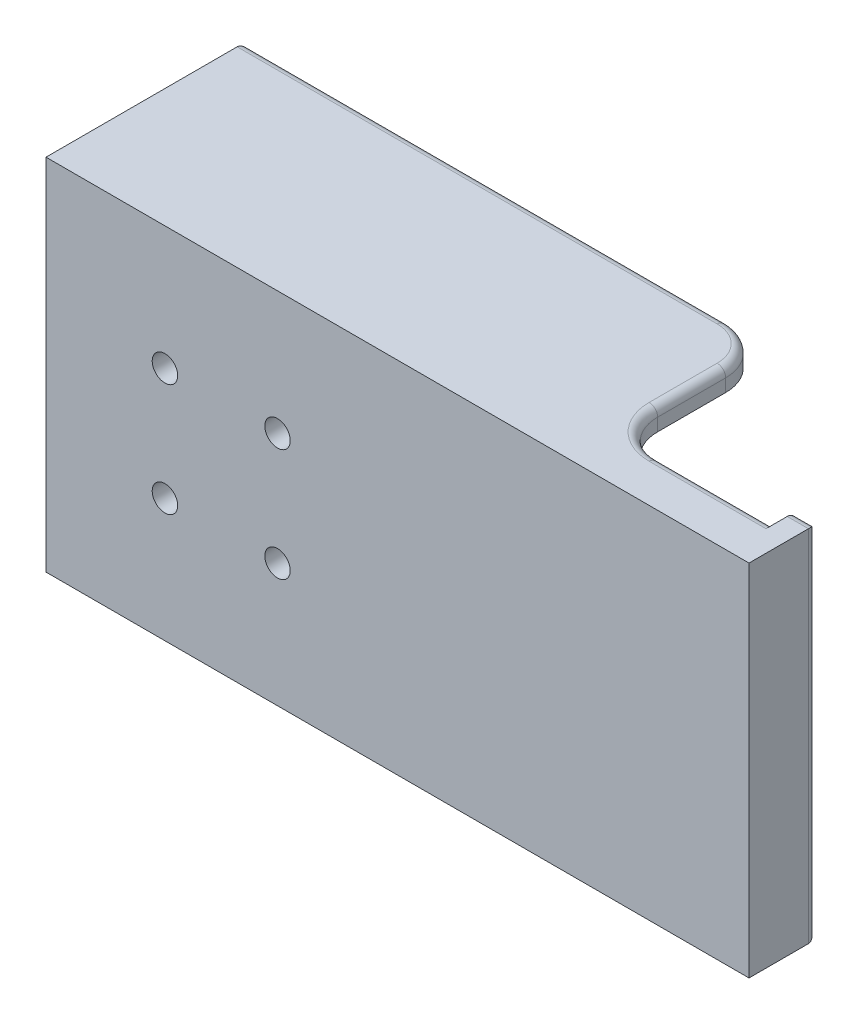
from build123d import *

# Parameters (mm, degrees)
CROQUIS1_W                 = 118
CROQUIS1_H                 = 84.6
SALIENTE_EXTRUIR1_DEPTH    = 36
CROQUIS2_W                 = 36
CROQUIS2_H                 = 74.6
CORTAR_EXTRUIR1_DEPTH      = 120
CORTAR_EXTRUIR3_DEPTH      = 110.243581047
SALIENTE_EXTRUIR2_DEPTH    = 84.6
CROQUIS8_W                 = 160.5
CROQUIS8_H                 = 84.6
SALIENTE_EXTRUIR3_DEPTH    = 5
CROQUIS9_W                 = 41
CROQUIS9_H                 = 84.6
SALIENTE_EXTRUIR4_DEPTH    = 5
CROQUIS10_W                = 5
CROQUIS10_H                = 84.6
SALIENTE_EXTRUIR5_DEPTH    = 5
REDONDEO2_R                = 10
REDONDEO3_R                = 2
REDONDEO4_R                = 2
CROQUIS18_W                = 165.5
CROQUIS18_H                = 84.6
SALIENTE_EXTRUIR9_DEPTH    = 6
CORTAR_EXTRUIR6_DEPTH      = 120.584865263
CORTAR_EXTRUIR6_DEPTH_BACK = 120.584865263
CROQUIS11_R                = 6
CROQUIS16_R                = 6
SALIENTE_EXTRUIR8_DEPTH    = 5
CROQUIS17_R                = 3
CORTAR_EXTRUIR7_DEPTH      = 120.584865302


with BuildPart() as part:
    # Croquis1 → Saliente-Extruir1 (new body)
    with BuildSketch(Plane.XY):
        Rectangle(CROQUIS1_W, CROQUIS1_H)
    extrude(amount=SALIENTE_EXTRUIR1_DEPTH)

    # Croquis2 → Cortar-Extruir1 (cut)
    with BuildSketch(Plane(origin=(59, 0, 0), x_dir=(0, 0, -1), z_dir=(1, 0, 0))):
        with Locations((-18, 0)):
            Rectangle(CROQUIS2_W, CROQUIS2_H)
    extrude(amount=-CORTAR_EXTRUIR1_DEPTH, mode=Mode.SUBTRACT)


with BuildPart() as cortar_extruir1_piece_1:
    # of the separate pieces the step leaves, piece 1, a body of its own (cortar_extruir1_pieces)
    add(part.part.solids().sort_by_distance((-59, -42.3, 0))[0])


with BuildPart() as cortar_extruir1_piece_2:
    # of the separate pieces the step leaves, piece 2, a body of its own (cortar_extruir1_pieces)
    add(part.part.solids().sort_by_distance((-59, 42.3, 0))[0])


with BuildPart() as cortar_extruir3_tool:
    # Croquis6 → Cortar-Extruir3 (new, through all)
    with BuildSketch(Plane.XZ.offset(42.3)):
        with BuildLine():
            Line((-59, 0), (-59, 36))
            Line((-59, 36), (0, 36))
            ThreePointArc((0, 36), (-33.535731191, 24.614115008), (-59, 0))
        make_face()
    extrude(amount=-CORTAR_EXTRUIR3_DEPTH)


with BuildPart() as cortar_extruir1_piece_1_1:
    add(cortar_extruir1_piece_1.part)

    # Cortar-Extruir3: cut by cortar_extruir3_tool
    add(cortar_extruir3_tool.part, mode=Mode.SUBTRACT)



with BuildPart() as cortar_extruir1_piece_2_1:
    add(cortar_extruir1_piece_2.part)

    # Cortar-Extruir3: cut by cortar_extruir3_tool
    add(cortar_extruir3_tool.part, mode=Mode.SUBTRACT)


with BuildPart() as body_3:
    # Croquis7 → Saliente-Extruir2 (new, through all)
    with BuildSketch(Plane.XZ.offset(-42.3)):
        with BuildLine():
            Line((-59, 0), (-59, 36))
            Line((-59, 36), (0, 36))
            ThreePointArc((0, 36), (-33.535731191, 24.614115008), (-59, 0))
        make_face()
    extrude(amount=SALIENTE_EXTRUIR2_DEPTH)


with BuildPart() as cortar_extruir1_piece_1_2:
    add(cortar_extruir1_piece_1_1.part)

    add(cortar_extruir1_piece_2_1.part)  # Saliente-Extruir3 merges Cortar-Extruir1 piece 2

    add(body_3.part)  # Saliente-Extruir3 merges body 3
    # Croquis8 → Saliente-Extruir3 (add)
    with BuildSketch(Plane.XY.offset(36)):
        with Locations((21.25, 0)):
            Rectangle(CROQUIS8_W, CROQUIS8_H)
    extrude(amount=SALIENTE_EXTRUIR3_DEPTH)

    # Croquis9 → Saliente-Extruir4 (add)
    with BuildSketch(Plane.ZY.offset(59)):
        with Locations((20.5, 0)):
            Rectangle(CROQUIS9_W, CROQUIS9_H)
    extrude(amount=SALIENTE_EXTRUIR4_DEPTH)

    # Croquis10 → Saliente-Extruir5 (add)
    with BuildSketch(Plane(origin=(0, 0, 36), x_dir=(-1, 0, 0), z_dir=(0, 0, -1))):
        with Locations((-99, 0)):
            Rectangle(CROQUIS10_W, CROQUIS10_H)
    extrude(amount=SALIENTE_EXTRUIR5_DEPTH)

    # Redondeo2
    redondeo2_edges = [cortar_extruir1_piece_1_2.edges().sort_by_distance(p)[0] for p in [
        (59, -39.8, 36),
        (59, -39.8, 0),
        (59, 39.8, 36),
        (59, 39.8, 0),
    ]]
    fillet(redondeo2_edges, radius=REDONDEO2_R)

    # Redondeo3
    redondeo3_edges = [cortar_extruir1_piece_1_2.edges().sort_by_distance(p)[0] for p in [
        (101.5, 0, 31),
        (99, -42.3, 31),
        (99, 42.3, 31),
    ]]
    fillet(redondeo3_edges, radius=REDONDEO3_R)

    # Redondeo4
    redondeo4_edges = [cortar_extruir1_piece_1_2.edges().sort_by_distance(p)[0] for p in [
        (-7.5, -42.3, 0),
        (-64, 0, 0),
        (82.75, 42.3, 36),
        (82.75, -42.3, 36),
        (59, -42.3, 18),
        (-7.5, 42.3, 0),
        (56.071067812, -42.3, 2.928932188),
        (59, 42.3, 18),
        (56.071067812, 42.3, 2.928932188),
        (61.928932188, -42.3, 33.071067812),
        (61.928932188, 42.3, 33.071067812),
    ]]
    fillet(redondeo4_edges, radius=REDONDEO4_R)

    # Croquis18 → Saliente-Extruir9 (add)
    with BuildSketch(Plane.XY.offset(41)):
        with Locations((18.75, 0)):
            Rectangle(CROQUIS18_W, CROQUIS18_H)
    extrude(amount=SALIENTE_EXTRUIR9_DEPTH)

    # Croquis11 → Cortar-Extruir6 (cut, two sides: drawn at the far end of the back side and taken through both)
    with BuildSketch(Plane.XY.offset(47).offset(-CORTAR_EXTRUIR6_DEPTH_BACK)):
        with Locations((-36, 13.25)):
            Circle(CROQUIS11_R)
        with Locations((-9.5, 13.25)):
            Circle(CROQUIS11_R)
        with Locations((-9.5, -13.25)):
            Circle(CROQUIS11_R)
        with Locations((-36, -13.25)):
            Circle(CROQUIS11_R)
    extrude(amount=CORTAR_EXTRUIR6_DEPTH + CORTAR_EXTRUIR6_DEPTH_BACK, mode=Mode.SUBTRACT)

    # Croquis16 → Saliente-Extruir8 (add)
    with BuildSketch(Plane.XY.offset(47)):
        with Locations((-9.5, 13.25)):
            Circle(CROQUIS16_R)
        with Locations((-36, -13.25)):
            Circle(CROQUIS16_R)
        with Locations((-9.5, -13.25)):
            Circle(CROQUIS16_R)
        with Locations((-36, 13.25)):
            Circle(CROQUIS16_R)
    extrude(amount=-SALIENTE_EXTRUIR8_DEPTH)

    # Croquis17 → Cortar-Extruir7 (cut, through all)
    with BuildSketch(Plane.XY.offset(47)):
        with Locations((-9.5, 13.25)):
            Circle(CROQUIS17_R)
        with Locations((-36, 13.25)):
            Circle(CROQUIS17_R)
        with Locations((-9.5, -13.25)):
            Circle(CROQUIS17_R)
        with Locations((-36, -13.25)):
            Circle(CROQUIS17_R)
    extrude(amount=-CORTAR_EXTRUIR7_DEPTH, mode=Mode.SUBTRACT)


solid = cortar_extruir1_piece_1_2.part
